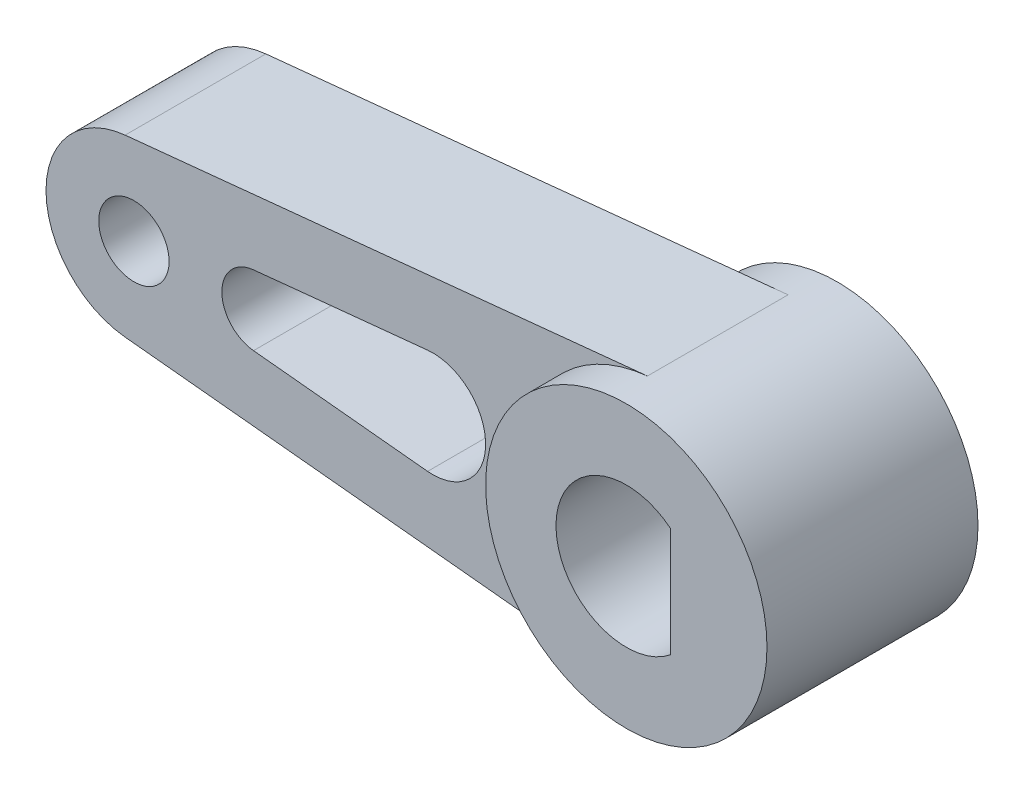
from build123d import *

# Parameters (mm, degrees)
SKETCH_1_R          = 2
EXTRUDE_1_DEPTH     = 6
CUT_EXTRUDE_START   = -4
CUT_EXTRUDE_2_DEPTH = 2
CUT_EXTRUDE_START_2 = 6
CUT_EXTRUDE_3_DEPTH = 2


with BuildPart() as part:
    # 草图1 → 凸台-拉伸1 (new, symmetric)
    with BuildSketch(Plane.XY):
        with BuildLine():
            Line((-30.5, 4.974937186), (-0.8, 7.959899497))
            ThreePointArc((-0.8, 7.959899497), (8, 0), (-0.8, -7.959899497))
            Line((-0.8, -7.959899497), (-30.5, -4.974937186))
            ThreePointArc((-30.5, -4.974937186), (-35, 0), (-30.5, 4.974937186))
        make_face()
        with Locations((-30, 0)):
            Circle(SKETCH_1_R, mode=Mode.SUBTRACT)
        with BuildLine():
            Line((-23.2, 1.989974874), (-13.3, 2.984962311))
            ThreePointArc((-13.3, 2.984962311), (-10, 0), (-13.3, -2.984962311))
            Line((-13.3, -2.984962311), (-23.2, -1.989974874))
            ThreePointArc((-23.2, -1.989974874), (-25, 0), (-23.2, 1.989974874))
        make_face(mode=Mode.SUBTRACT)
        with BuildLine():
            Line((2.5, 3.122498999), (2.5, -3.122498999))
            ThreePointArc((2.5, -3.122498999), (-4, 0), (2.5, 3.122498999))
        make_face(mode=Mode.SUBTRACT)
    extrude(amount=EXTRUDE_1_DEPTH, both=True)

    # 草图2 → 切除-拉伸2 (cut)
    with BuildSketch(Plane.XY.offset(CUT_EXTRUDE_START)):
        with BuildLine():
            Line((-30.5, -4.974937186), (-0.8, -7.959899497))
            ThreePointArc((-0.8, -7.959899497), (-8, 0), (-0.8, 7.959899497))
            Line((-0.8, 7.959899497), (-30.5, 4.974937186))
            ThreePointArc((-30.5, 4.974937186), (-35, 0), (-30.5, -4.974937186))
        make_face()
    extrude(amount=-CUT_EXTRUDE_2_DEPTH, mode=Mode.SUBTRACT)

    # 草图2<2> → 切除-拉伸3 (cut)
    with BuildSketch(Plane.XY.offset(CUT_EXTRUDE_START_2)):
        with BuildLine():
            Line((-30.5, -4.974937186), (-0.8, -7.959899497))
            ThreePointArc((-0.8, -7.959899497), (-8, 0), (-0.8, 7.959899497))
            Line((-0.8, 7.959899497), (-30.5, 4.974937186))
            ThreePointArc((-30.5, 4.974937186), (-35, 0), (-30.5, -4.974937186))
        make_face()
    extrude(amount=-CUT_EXTRUDE_3_DEPTH, mode=Mode.SUBTRACT)


solid = part.part
